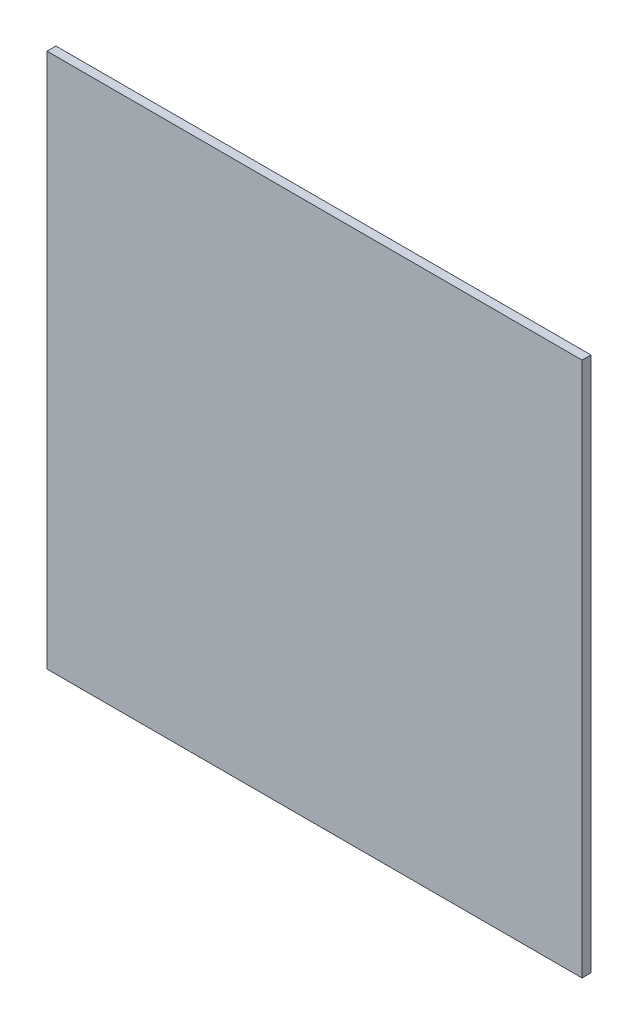
from build123d import *

# Parameters (mm, degrees)
ESBO_O2_W                = 180
ESBO_O2_H                = 180
RESSALTO_EXTRUS_O1_DEPTH = 3


with BuildPart() as part:
    # Esboço2 → Ressalto-extrusão1 (new body)
    with BuildSketch(Plane.XY):
        Rectangle(ESBO_O2_W, ESBO_O2_H)
    extrude(amount=RESSALTO_EXTRUS_O1_DEPTH)


solid = part.part
